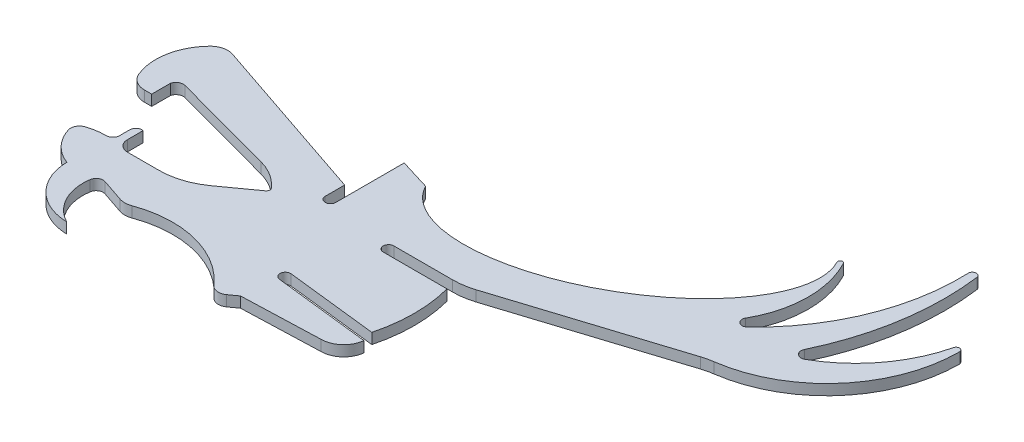
from build123d import *

# Parameters (mm, degrees)
BOSS_EXTRUDE2_DEPTH = 3


with BuildPart() as part:
    # Sketch1 → Boss-Extrude2 (new body)
    with BuildSketch(Plane(origin=(0, 0, 0), x_dir=(1, 0, 0), z_dir=(0, 1, 0))):
        with BuildLine():
            Line((83.639689367, 6.764475065), (35.667186692, -8.49628906))
            ThreePointArc((35.667186692, -8.49628906), (32.821791297, -9.165503452), (29.907418735, -9.39034879))
            Line((29.907418735, -9.39034879), (13.331621464, -9.39034879))
            ThreePointArc((13.331621464, -9.39034879), (11.831621464, -10.89034879), (13.331621464, -12.39034879))
            Line((13.331621464, -12.39034879), (31.335553361, -12.39034879))
            ThreePointArc((31.335553361, -12.39034879), (32.706920816, -23.000925987), (31.335553361, -33.611503185))
            Line((31.335553361, -33.611503185), (5.672878156, -30.687610674))
            ThreePointArc((5.672878156, -30.687610674), (4.012715552, -32.008163637), (5.333268515, -33.668326241))
            Line((5.333268515, -33.668326241), (32.258758745, -36.73609835))
            ThreePointArc((32.258758745, -36.73609835), (30.141236011, -40.825580171), (25.83833159, -42.466548678))
            Line((25.83833159, -42.466548678), (3.931607644, -43.234741077))
            Line((3.931607644, -43.234741077), (1.645004408, -44.879459267))
            ThreePointArc((1.645004408, -44.879459267), (-0.44755249, -45.424610965), (-2.363050322, -44.421190413))
            ThreePointArc((-2.363050322, -44.421190413), (-16.657617756, -35.649988568), (-33.406545395, -36.511419261))
            ThreePointArc((-33.406545395, -36.511419261), (-35.065515769, -36.818007167), (-36.732015424, -36.555409102))
            Line((-36.732015424, -36.555409102), (-43.072013441, -34.41346595))
            ThreePointArc((-43.072013441, -34.41346595), (-44.756883472, -34.602804193), (-45.690953078, -36.017777677))
            ThreePointArc((-45.690953078, -36.017777677), (-44.377060251, -43.944176391), (-38.701961301, -49.631650596))
            ThreePointArc((-38.701961301, -49.631650596), (-48.89375638, -45.294039559), (-53.199015105, -35.088535957))
            ThreePointArc((-53.199015105, -35.088535957), (-57.963880411, -31.924307539), (-60.880420097, -27.003933658))
            ThreePointArc((-60.880420097, -27.003933658), (-60.719986784, -25.061085947), (-59.232742508, -23.80072864))
            ThreePointArc((-59.232742508, -23.80072864), (-56.720776297, -23.205324241), (-54.14697512, -23.005253893))
            ThreePointArc((-54.14697512, -23.005253893), (-52.817288904, -22.454479829), (-52.26651484, -21.124793613))
            Line((-52.26651484, -21.124793613), (-52.26651484, -18.255253893))
            ThreePointArc((-52.26651484, -18.255253893), (-51.768596368, -17.053172365), (-50.56651484, -16.555253893))
            Line((-50.56651484, -16.555253893), (-50.18504008, -16.555253893))
            Line((-50.18504008, -16.555253893), (-50.18504008, -21.008976099))
            ThreePointArc((-50.18504008, -21.008976099), (-49.292805972, -23.163019785), (-47.138762286, -24.055253893))
            Line((-47.138762286, -24.055253893), (-38.258057554, -24.055253893))
            ThreePointArc((-38.258057554, -24.055253893), (-32.429820226, -23.139270307), (-27.163537606, -20.479638066))
            Line((-27.163537606, -20.479638066), (-18.213895237, -14.042299326))
            ThreePointArc((-18.213895237, -14.042299326), (-17.803794916, -13.348327859), (-18.036830501, -12.576658832))
            ThreePointArc((-18.036830501, -12.576658832), (-21.621060958, -9.471725354), (-25.963310125, -7.565894288))
            Line((-25.963310125, -7.565894288), (-55.30954126, 0.349304832))
            ThreePointArc((-55.30954126, 0.349304832), (-56.903028243, 0.142191478), (-57.883342437, -1.131025232))
            Line((-57.883342437, -1.131025232), (-57.883342437, -6.467193959))
            Line((-57.883342437, -6.467193959), (-59.970418868, -6.467193959))
            ThreePointArc((-59.970418868, -6.467193959), (-62.745333472, -5.626502668), (-64.58710946, -3.387133535))
            ThreePointArc((-64.58710946, -3.387133535), (-65.510981808, 5.487804074), (-61.413967112, 13.414501258))
            ThreePointArc((-61.413967112, 13.414501258), (-58.998069827, 14.801189981), (-56.215124926, 14.680016601))
            Line((-56.215124926, 14.680016601), (-8.465601761, -1.451970173))
            Line((-8.465601761, -1.451970173), (-8.465601761, -6.951970173))
            ThreePointArc((-8.465601761, -6.951970173), (-6.965601761, -8.451970173), (-5.465601761, -6.951970173))
            Line((-5.465601761, -6.951970173), (-5.465601761, 12.336199013))
            Line((-5.465601761, 12.336199013), (3.240530108, 9.661679805))
            add(Edge.make_bspline(
                [(3.240530108, 9.661679805), (13.894797432, -11.003486244), (52.167573777, 8.728675087), (90.440350123, 28.460836418), (79.7860828, 49.126002466)],
                knots=[0, 0, 0, 1.570796327, 1.570796327, 3.141592654, 3.141592654, 3.141592654], degree=2, weights=[1, 0.707106781, 1, 0.707106781, 1]))
            ThreePointArc((79.7860828, 49.126002466), (80.072864648, 50.032062802), (80.980537261, 49.750425469))
            ThreePointArc((80.980537261, 49.750425469), (84.258913327, 36.128474368), (80.573020022, 22.611096962))
            ThreePointArc((80.573020022, 22.611096962), (80.977131886, 20.56443692), (83.060820169, 20.666254716))
            ThreePointArc((83.060820169, 20.666254716), (96.799731472, 40.865743936), (100.995247842, 64.931792447))
            ThreePointArc((100.995247842, 64.931792447), (102.023911204, 66.097176073), (103.234366802, 65.121950687))
            ThreePointArc((103.234366802, 65.121950687), (102.922479327, 43.686615501), (96.524889391, 23.225879655))
            ThreePointArc((96.524889391, 23.225879655), (96.918331366, 21.131130375), (99.034577715, 20.877610113))
            ThreePointArc((99.034577715, 20.877610113), (110.533106389, 30.92010294), (117.098161764, 44.70298623))
            ThreePointArc((117.098161764, 44.70298623), (118.133339849, 45.419031095), (118.968319872, 44.477159407))
            ThreePointArc((118.968319872, 44.477159407), (109.792721336, 19.953626833), (86.773007072, 7.476126539))
            ThreePointArc((86.773007072, 7.476126539), (85.19127768, 7.186654615), (83.639689367, 6.764475065))
        make_face()
    extrude(amount=BOSS_EXTRUDE2_DEPTH)


solid = part.part
